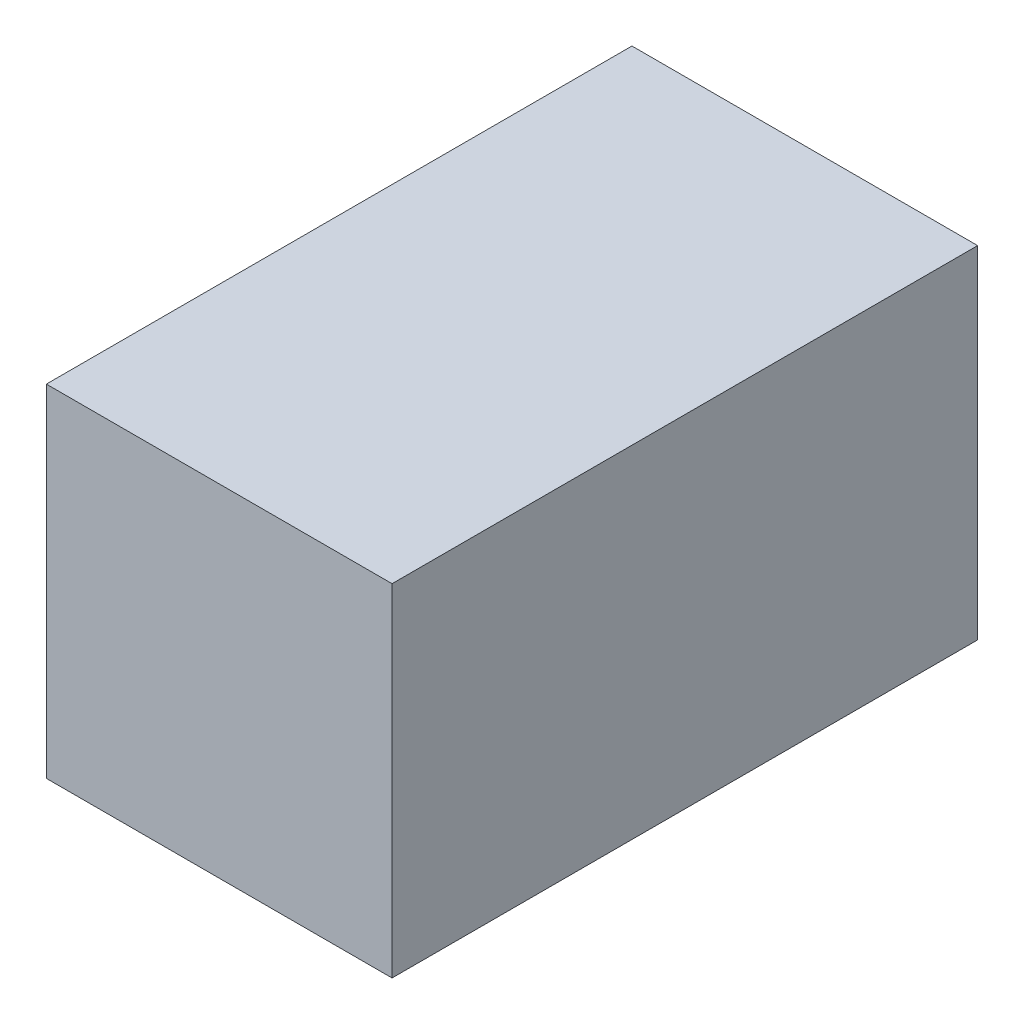
from build123d import *

# Parameters (mm, degrees)
SKETCH1_W           = 73.025
SKETCH1_H           = 72.136
BOSS_EXTRUDE1_DEPTH = 123.698


with BuildPart() as part:
    # Sketch1 → Boss-Extrude1 (new body)
    with BuildSketch(Plane.XY):
        Rectangle(SKETCH1_W, SKETCH1_H)
    extrude(amount=BOSS_EXTRUDE1_DEPTH)


solid = part.part
